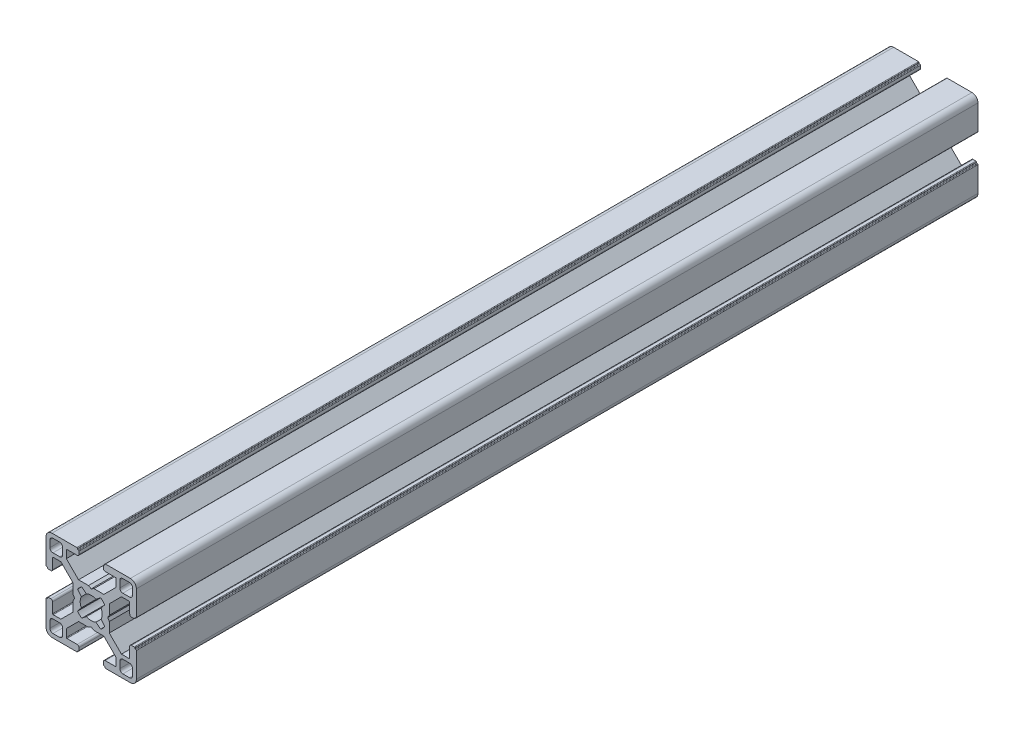
from build123d import *

# Parameters (mm, degrees)
BOSS_EXTRUDE1_DEPTH = 279.4


with BuildPart() as part:
    # Sketch1 → Boss-Extrude1 (new body)
    with BuildSketch(Plane.XY):
        with BuildLine():
            Line((6.00446543, 0.899999619), (5.484852164, 0))
            Line((5.484852164, 0), (6.00446543, -0.899999619))
            Line((6.00446543, -0.899999619), (6.00446543, -4.204465866))
            Line((6.00446543, -4.204465866), (10.049999564, -8.25))
            Line((10.049999564, -8.25), (12.59999928, -8.25))
            ThreePointArc((12.59999928, -8.25), (12.741420837, -8.191421273), (12.799999564, -8.049999716))
            Line((12.799999564, -8.049999716), (12.799999564, -4.649999613))
            ThreePointArc((12.799999564, -4.649999613), (12.975735606, -4.225735278), (13.39999994, -4.049999237))
            Line((13.39999994, -4.049999237), (14.300000043, -4.049999237))
            ThreePointArc((14.300000043, -4.049999237), (14.4414216, -4.108577964), (14.500000327, -4.249999521))
            Line((14.500000327, -4.249999521), (14.500000327, -4.349998953))
            ThreePointArc((14.500000327, -4.349998953), (14.558579054, -4.49142051), (14.700000611, -4.549999237))
            Line((14.700000611, -4.549999237), (14.799999716, -4.549999237))
            ThreePointArc((14.799999716, -4.549999237), (14.941421273, -4.608577964), (15, -4.749999521))
            Line((15, -4.749999521), (15, -13.000000346))
            ThreePointArc((15, -13.000000346), (14.414213664, -14.414213664), (13.000000346, -15))
            Line((13.000000346, -15), (4.749999945, -15))
            ThreePointArc((4.749999945, -15), (4.60857832, -14.941421245), (4.549999564, -14.799999619))
            Line((4.549999564, -14.799999619), (4.549999564, -14.69999942))
            ThreePointArc((4.549999564, -14.69999942), (4.49142109, -14.558578474), (4.350000144, -14.5))
            Line((4.350000144, -14.5), (4.250000374, -14.5))
            ThreePointArc((4.250000374, -14.5), (4.108578753, -14.441421247), (4.05, -14.299999626))
            Line((4.05, -14.299999626), (4.05, -13.399999434))
            ThreePointArc((4.05, -13.399999434), (4.225735989, -12.975735226), (4.650000197, -12.799999237))
            Line((4.650000197, -12.799999237), (8.049999924, -12.799999237))
            ThreePointArc((8.049999924, -12.799999237), (8.191421565, -12.741420475), (8.250000327, -12.599998834))
            Line((8.250000327, -12.599998834), (8.250000327, -10.049999237))
            Line((8.250000327, -10.049999237), (4.204466193, -6))
            Line((4.204466193, -6), (0.899999946, -6))
            Line((0.899999946, -6), (0, -5.484851837))
            Line((0, -5.484851837), (-0.899999946, -6))
            Line((-0.899999946, -6), (-4.204466193, -6))
            Line((-4.204466193, -6), (-8.250000327, -10.049999237))
            Line((-8.250000327, -10.049999237), (-8.250000327, -12.599998834))
            ThreePointArc((-8.250000327, -12.599998834), (-8.191421565, -12.741420475), (-8.049999924, -12.799999237))
            Line((-8.049999924, -12.799999237), (-4.650000197, -12.799999237))
            ThreePointArc((-4.650000197, -12.799999237), (-4.225735989, -12.975735226), (-4.05, -13.399999434))
            Line((-4.05, -13.399999434), (-4.05, -14.299999626))
            ThreePointArc((-4.05, -14.299999626), (-4.108578753, -14.441421247), (-4.250000374, -14.5))
            Line((-4.250000374, -14.5), (-4.350000144, -14.5))
            ThreePointArc((-4.350000144, -14.5), (-4.49142109, -14.558578474), (-4.549999564, -14.69999942))
            Line((-4.549999564, -14.69999942), (-4.549999564, -14.799999619))
            ThreePointArc((-4.549999564, -14.799999619), (-4.60857832, -14.941421245), (-4.749999945, -15))
            Line((-4.749999945, -15), (-13.000000346, -15))
            ThreePointArc((-13.000000346, -15), (-14.414213664, -14.414213664), (-15, -13.000000346))
            Line((-15, -13.000000346), (-15, -4.749999521))
            ThreePointArc((-15, -4.749999521), (-14.941421273, -4.608577964), (-14.799999716, -4.549999237))
            Line((-14.799999716, -4.549999237), (-14.700000611, -4.549999237))
            ThreePointArc((-14.700000611, -4.549999237), (-14.558579054, -4.49142051), (-14.500000327, -4.349998953))
            Line((-14.500000327, -4.349998953), (-14.500000327, -4.249999521))
            ThreePointArc((-14.500000327, -4.249999521), (-14.4414216, -4.108577964), (-14.300000043, -4.049999237))
            Line((-14.300000043, -4.049999237), (-13.39999994, -4.049999237))
            ThreePointArc((-13.39999994, -4.049999237), (-12.975735606, -4.225735278), (-12.799999564, -4.649999613))
            Line((-12.799999564, -4.649999613), (-12.799999564, -8.049999716))
            ThreePointArc((-12.799999564, -8.049999716), (-12.741420837, -8.191421273), (-12.59999928, -8.25))
            Line((-12.59999928, -8.25), (-10.049999564, -8.25))
            Line((-10.049999564, -8.25), (-6.00446543, -4.204465866))
            Line((-6.00446543, -4.204465866), (-6.00446543, -0.899999619))
            Line((-6.00446543, -0.899999619), (-5.484852164, 0))
            Line((-5.484852164, 0), (-6.00446543, 0.899999619))
            Line((-6.00446543, 0.899999619), (-6.00446543, 4.204465866))
            Line((-6.00446543, 4.204465866), (-10.049999564, 8.25))
            Line((-10.049999564, 8.25), (-12.59999928, 8.25))
            ThreePointArc((-12.59999928, 8.25), (-12.741420837, 8.191421273), (-12.799999564, 8.049999716))
            Line((-12.799999564, 8.049999716), (-12.799999564, 4.649999613))
            ThreePointArc((-12.799999564, 4.649999613), (-12.975735606, 4.225735278), (-13.39999994, 4.049999237))
            Line((-13.39999994, 4.049999237), (-14.300000043, 4.049999237))
            ThreePointArc((-14.300000043, 4.049999237), (-14.4414216, 4.108577964), (-14.500000327, 4.249999521))
            Line((-14.500000327, 4.249999521), (-14.500000327, 4.349998953))
            ThreePointArc((-14.500000327, 4.349998953), (-14.558579054, 4.49142051), (-14.700000611, 4.549999237))
            Line((-14.700000611, 4.549999237), (-14.799999716, 4.549999237))
            ThreePointArc((-14.799999716, 4.549999237), (-14.941421273, 4.608577964), (-15, 4.749999521))
            Line((-15, 4.749999521), (-15, 13.000000346))
            ThreePointArc((-15, 13.000000346), (-14.414213664, 14.414213664), (-13.000000346, 15))
            Line((-13.000000346, 15), (-4.749999945, 15))
            ThreePointArc((-4.749999945, 15), (-4.60857832, 14.941421245), (-4.549999564, 14.799999619))
            Line((-4.549999564, 14.799999619), (-4.549999564, 14.69999942))
            ThreePointArc((-4.549999564, 14.69999942), (-4.49142109, 14.558578474), (-4.350000144, 14.5))
            Line((-4.350000144, 14.5), (-4.250000374, 14.5))
            ThreePointArc((-4.250000374, 14.5), (-4.108578753, 14.441421247), (-4.05, 14.299999626))
            Line((-4.05, 14.299999626), (-4.05, 13.399999434))
            ThreePointArc((-4.05, 13.399999434), (-4.225735989, 12.975735226), (-4.650000197, 12.799999237))
            Line((-4.650000197, 12.799999237), (-8.049999924, 12.799999237))
            ThreePointArc((-8.049999924, 12.799999237), (-8.191421565, 12.741420475), (-8.250000327, 12.599998834))
            Line((-8.250000327, 12.599998834), (-8.250000327, 10.049999237))
            Line((-8.250000327, 10.049999237), (-4.204466193, 6))
            Line((-4.204466193, 6), (-0.899999946, 6))
            Line((-0.899999946, 6), (0, 5.484851837))
            Line((0, 5.484851837), (0.899999946, 6))
            Line((0.899999946, 6), (4.204466193, 6))
            Line((4.204466193, 6), (8.250000327, 10.049999237))
            Line((8.250000327, 10.049999237), (8.250000327, 12.599998834))
            ThreePointArc((8.250000327, 12.599998834), (8.191421565, 12.741420475), (8.049999924, 12.799999237))
            Line((8.049999924, 12.799999237), (4.650000197, 12.799999237))
            ThreePointArc((4.650000197, 12.799999237), (4.225735989, 12.975735226), (4.05, 13.399999434))
            Line((4.05, 13.399999434), (4.05, 14.299999626))
            ThreePointArc((4.05, 14.299999626), (4.108578753, 14.441421247), (4.250000374, 14.5))
            Line((4.250000374, 14.5), (4.350000144, 14.5))
            ThreePointArc((4.350000144, 14.5), (4.49142109, 14.558578474), (4.549999564, 14.69999942))
            Line((4.549999564, 14.69999942), (4.549999564, 14.799999619))
            ThreePointArc((4.549999564, 14.799999619), (4.60857832, 14.941421245), (4.749999945, 15))
            Line((4.749999945, 15), (13.000000346, 15))
            ThreePointArc((13.000000346, 15), (14.414213664, 14.414213664), (15, 13.000000346))
            Line((15, 13.000000346), (15, 4.749999521))
            ThreePointArc((15, 4.749999521), (14.941421273, 4.608577964), (14.799999716, 4.549999237))
            Line((14.799999716, 4.549999237), (14.700000611, 4.549999237))
            ThreePointArc((14.700000611, 4.549999237), (14.558579054, 4.49142051), (14.500000327, 4.349998953))
            Line((14.500000327, 4.349998953), (14.500000327, 4.249999521))
            ThreePointArc((14.500000327, 4.249999521), (14.4414216, 4.108577964), (14.300000043, 4.049999237))
            Line((14.300000043, 4.049999237), (13.39999994, 4.049999237))
            ThreePointArc((13.39999994, 4.049999237), (12.975735606, 4.225735278), (12.799999564, 4.649999613))
            Line((12.799999564, 4.649999613), (12.799999564, 8.049999716))
            ThreePointArc((12.799999564, 8.049999716), (12.741420837, 8.191421273), (12.59999928, 8.25))
            Line((12.59999928, 8.25), (10.049999564, 8.25))
            Line((10.049999564, 8.25), (6.00446543, 4.204465866))
            Line((6.00446543, 4.204465866), (6.00446543, 0.899999619))
        make_face()
        with BuildLine():
            Line((13.70000109, 12.700000398), (13.70000109, 10.499999635))
            ThreePointArc((13.70000109, 10.499999635), (13.407107874, 9.792892851), (12.70000109, 9.499999635))
            Line((12.70000109, 9.499999635), (10.500000327, 9.499999635))
            ThreePointArc((10.500000327, 9.499999635), (9.792893543, 9.792892851), (9.500000327, 10.499999635))
            Line((9.500000327, 10.499999635), (9.500000327, 12.700000398))
            ThreePointArc((9.500000327, 12.700000398), (9.792893543, 13.407107182), (10.500000327, 13.700000398))
            Line((10.500000327, 13.700000398), (12.70000109, 13.700000398))
            ThreePointArc((12.70000109, 13.700000398), (13.407107874, 13.407107182), (13.70000109, 12.700000398))
        make_face(mode=Mode.SUBTRACT)
        with BuildLine():
            Line((3.135929412, 4.518400903), (1.600129524, 3.280561767))
            ThreePointArc((1.600129524, 3.280561767), (0, 3.65), (-1.600129524, 3.280561767))
            Line((-1.600129524, 3.280561767), (-3.135929412, 4.518400903))
            ThreePointArc((-3.135929412, 4.518400903), (-3.881002259, 3.897155561), (-4.505336892, 3.154669473))
            Line((-4.505336892, 3.154669473), (-3.280561732, 1.600129597))
            ThreePointArc((-3.280561732, 1.600129597), (-3.65, 0), (-3.280561732, -1.600129597))
            Line((-3.280561732, -1.600129597), (-4.505336892, -3.154669473))
            ThreePointArc((-4.505336892, -3.154669473), (-3.881002259, -3.897155561), (-3.135929412, -4.518400903))
            Line((-3.135929412, -4.518400903), (-1.600129524, -3.280561767))
            ThreePointArc((-1.600129524, -3.280561767), (0, -3.65), (1.600129524, -3.280561767))
            Line((1.600129524, -3.280561767), (3.135929412, -4.518400903))
            ThreePointArc((3.135929412, -4.518400903), (3.881002259, -3.897155561), (4.505336892, -3.154669473))
            Line((4.505336892, -3.154669473), (3.280561732, -1.600129597))
            ThreePointArc((3.280561732, -1.600129597), (3.65, 0), (3.280561732, 1.600129597))
            Line((3.280561732, 1.600129597), (4.505336892, 3.154669473))
            ThreePointArc((4.505336892, 3.154669473), (3.881002259, 3.897155561), (3.135929412, 4.518400903))
        make_face(mode=Mode.SUBTRACT)
        with BuildLine():
            Line((-13.70000109, -12.700000398), (-13.70000109, -10.499999635))
            ThreePointArc((-13.70000109, -10.499999635), (-13.407107874, -9.792892851), (-12.70000109, -9.499999635))
            Line((-12.70000109, -9.499999635), (-10.500000327, -9.499999635))
            ThreePointArc((-10.500000327, -9.499999635), (-9.792893543, -9.792892851), (-9.500000327, -10.499999635))
            Line((-9.500000327, -10.499999635), (-9.500000327, -12.700000398))
            ThreePointArc((-9.500000327, -12.700000398), (-9.792893543, -13.407107182), (-10.500000327, -13.700000398))
            Line((-10.500000327, -13.700000398), (-12.70000109, -13.700000398))
            ThreePointArc((-12.70000109, -13.700000398), (-13.407107874, -13.407107182), (-13.70000109, -12.700000398))
        make_face(mode=Mode.SUBTRACT)
        with BuildLine():
            Line((10.500000327, -13.700000398), (12.70000109, -13.700000398))
            ThreePointArc((12.70000109, -13.700000398), (13.407107874, -13.407107182), (13.70000109, -12.700000398))
            Line((13.70000109, -12.700000398), (13.70000109, -10.499999635))
            ThreePointArc((13.70000109, -10.499999635), (13.407107874, -9.792892851), (12.70000109, -9.499999635))
            Line((12.70000109, -9.499999635), (10.500000327, -9.499999635))
            ThreePointArc((10.500000327, -9.499999635), (9.792893543, -9.792892851), (9.500000327, -10.499999635))
            Line((9.500000327, -10.499999635), (9.500000327, -12.700000398))
            ThreePointArc((9.500000327, -12.700000398), (9.792893543, -13.407107182), (10.500000327, -13.700000398))
        make_face(mode=Mode.SUBTRACT)
        with BuildLine():
            Line((-10.500000327, 13.700000398), (-12.70000109, 13.700000398))
            ThreePointArc((-12.70000109, 13.700000398), (-13.407107874, 13.407107182), (-13.70000109, 12.700000398))
            Line((-13.70000109, 12.700000398), (-13.70000109, 10.499999635))
            ThreePointArc((-13.70000109, 10.499999635), (-13.407107874, 9.792892851), (-12.70000109, 9.499999635))
            Line((-12.70000109, 9.499999635), (-10.500000327, 9.499999635))
            ThreePointArc((-10.500000327, 9.499999635), (-9.792893543, 9.792892851), (-9.500000327, 10.499999635))
            Line((-9.500000327, 10.499999635), (-9.500000327, 12.700000398))
            ThreePointArc((-9.500000327, 12.700000398), (-9.792893543, 13.407107182), (-10.500000327, 13.700000398))
        make_face(mode=Mode.SUBTRACT)
    extrude(amount=BOSS_EXTRUDE1_DEPTH)


solid = part.part
